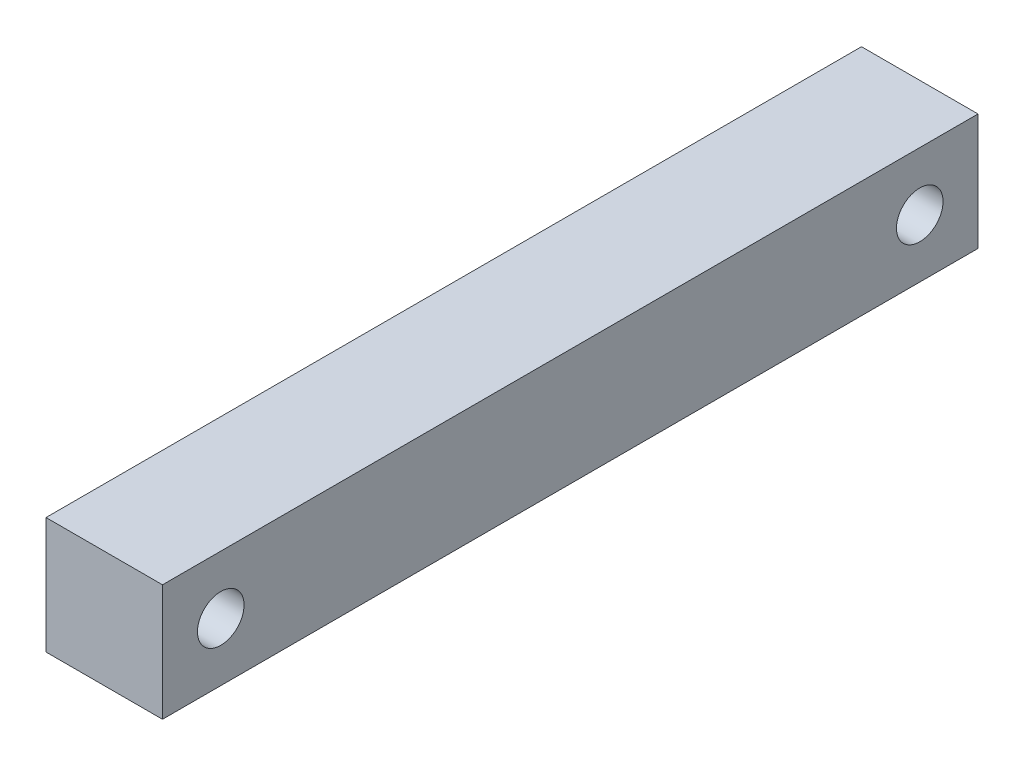
from build123d import *

# Parameters (mm, degrees)
SKETCH1_W           = 5
SKETCH1_H           = 35
BOSS_EXTRUDE1_DEPTH = 5
SKETCH2_R           = 1
CUT_EXTRUDE1_DEPTH  = 19.874586088


with BuildPart() as part:
    # Sketch1 → Boss-Extrude1 (new body)
    with BuildSketch(Plane(origin=(0, 0, 0), x_dir=(1, 0, 0), z_dir=(0, 1, 0))):
        Rectangle(SKETCH1_W, SKETCH1_H)
    extrude(amount=BOSS_EXTRUDE1_DEPTH)

    # Sketch2 → Cut-Extrude1 (cut, through all)
    with BuildSketch(Plane(origin=(2.5, 0, 0), x_dir=(0, 0, -1), z_dir=(1, 0, 0))):
        with Locations((15, 2.5)):
            Circle(SKETCH2_R)
    cut_extrude1 = extrude(amount=-CUT_EXTRUDE1_DEPTH, mode=Mode.SUBTRACT)

    # Mirror1: Cut-Extrude1 across plane
    add(cut_extrude1.mirror(Plane.XY), mode=Mode.SUBTRACT)


solid = part.part
